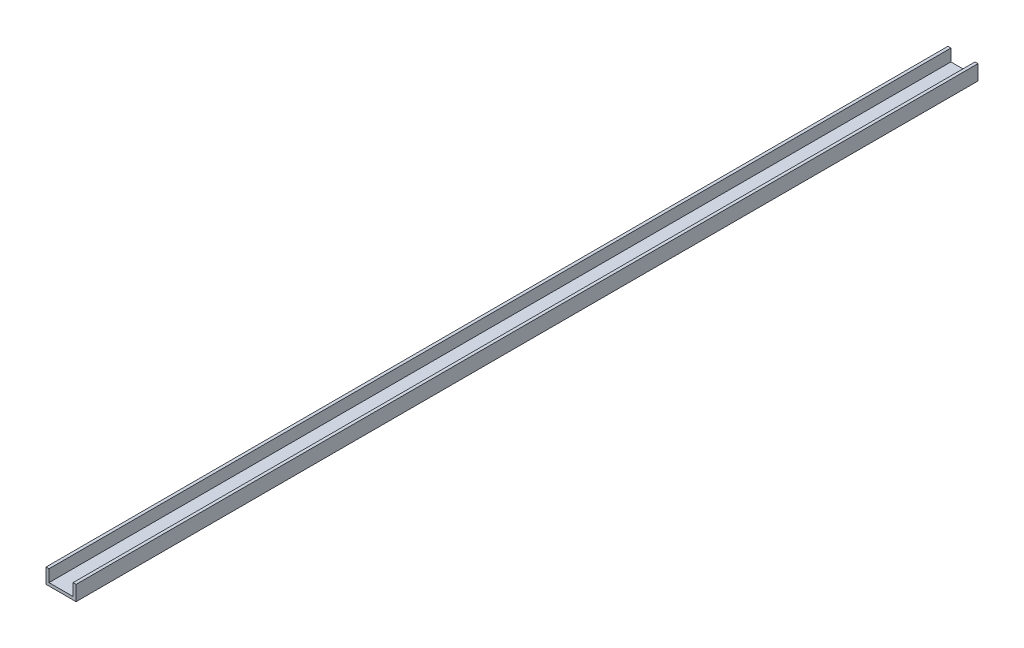
from build123d import *

# Parameters (mm, degrees)
EXTRUDE_1_DEPTH = 300


with BuildPart() as part:
    # 草图1 → 凸台-拉伸1 (new body)
    with BuildSketch(Plane.XY):
        Polygon((0, 0), (0, -5), (10, -5), (10, 0), (9, 0), (9, -4), (1, -4), (1, 0), align=None)
    extrude(amount=EXTRUDE_1_DEPTH)


solid = part.part
